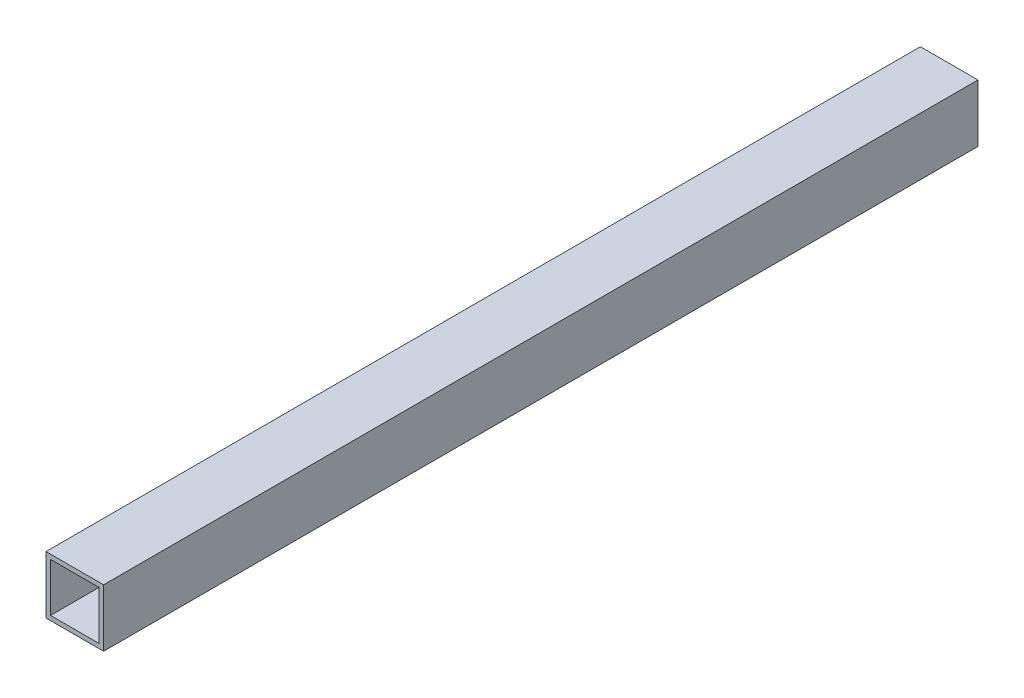
from build123d import *

# Parameters (mm, degrees)
SKETCH1_W           = 19.1
SKETCH1_H           = 19.1
SKETCH1_W_2         = 16.1
SKETCH1_H_2         = 16.1
BOSS_EXTRUDE1_DEPTH = 290


with BuildPart() as part:
    # Sketch1 → Boss-Extrude1 (new body)
    with BuildSketch(Plane.XY):
        Rectangle(SKETCH1_W, SKETCH1_H)
        Rectangle(SKETCH1_W_2, SKETCH1_H_2, mode=Mode.SUBTRACT)
    extrude(amount=BOSS_EXTRUDE1_DEPTH)


solid = part.part
